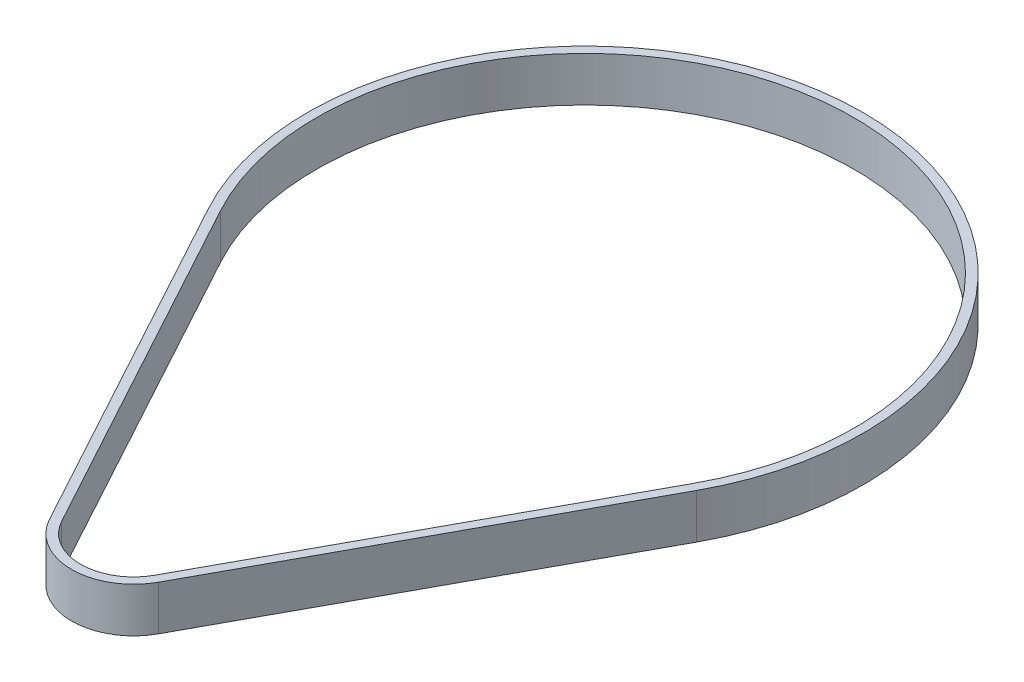
from build123d import *

# Parameters (mm, degrees)
EXTRUDE_1_DEPTH = 10


with BuildPart() as part:
    # 草图1 → 凸台-拉伸1 (new body)
    with BuildSketch(Plane(origin=(0, 0, 0), x_dir=(1, 0, 0), z_dir=(0, 1, 0))):
        with BuildLine():
            Line((12.17913919, -6.626220158), (54.557975845, 71.267018821))
            ThreePointArc((54.557975845, 71.267018821), (0, 163.06), (-54.557975845, 71.267018821))
            Line((-54.557975845, 71.267018821), (-12.17913919, -6.626220158))
            ThreePointArc((-12.17913919, -6.626220158), (0, -13.865), (12.17913919, -6.626220158))
        make_face()
        with BuildLine():
            ThreePointArc((52.801158075, 72.222838534), (0, 161.06), (-52.801158075, 72.222838534))
            Line((-52.801158075, 72.222838534), (-10.42232142, -5.670400446))
            ThreePointArc((-10.42232142, -5.670400446), (0, -11.865), (10.42232142, -5.670400446))
            Line((10.42232142, -5.670400446), (52.801158075, 72.222838534))
        make_face(mode=Mode.SUBTRACT)
    extrude(amount=EXTRUDE_1_DEPTH)


solid = part.part
